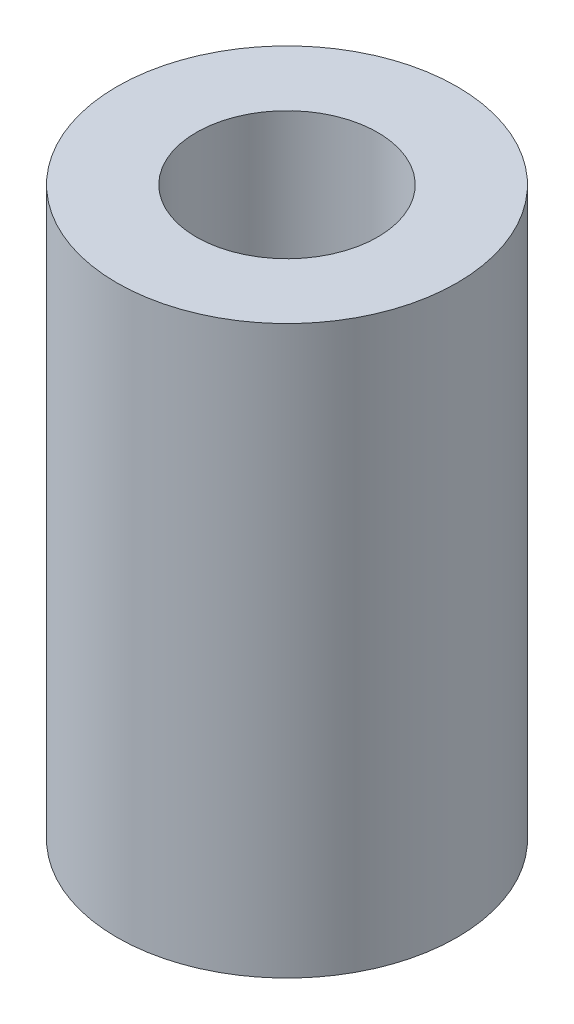
from build123d import *

# Parameters (mm, degrees)
SKETCH_1_R      = 3
SKETCH_1_R_2    = 1.6
EXTRUDE_1_DEPTH = 10


with BuildPart() as part:
    # 草圖1 → 填料-伸長1 (new body)
    with BuildSketch(Plane(origin=(0, 0, 0), x_dir=(1, 0, 0), z_dir=(0, 1, 0))):
        with Locations(Location((0, 0, 0), (0, 0, 270))):
            Circle(SKETCH_1_R)
        with Locations(Location((0, 0, 0), (0, 0, 270))):
            Circle(SKETCH_1_R_2, mode=Mode.SUBTRACT)
    extrude(amount=EXTRUDE_1_DEPTH)


solid = part.part
